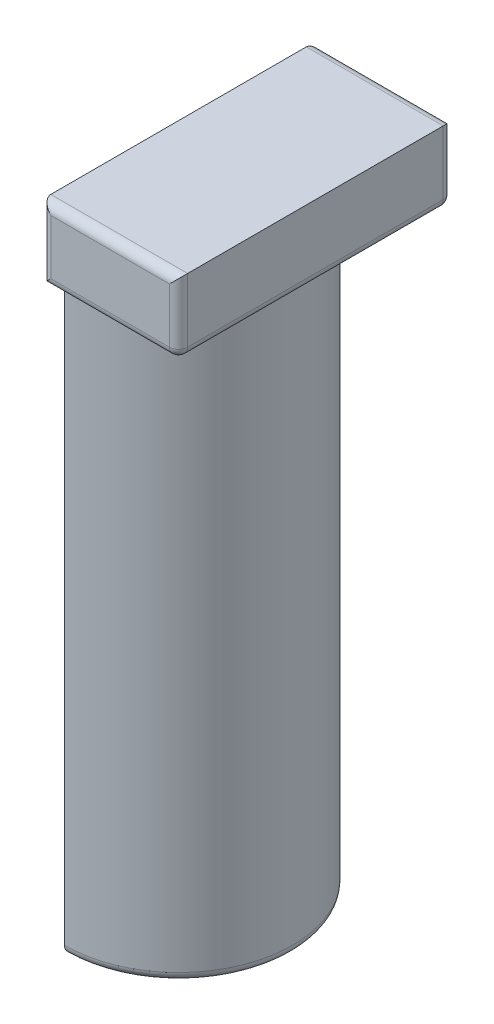
from build123d import *

# Parameters (mm, degrees)
SKETCH_1_W          = 30
SKETCH_1_H          = 30
EXTRUDE_1_DEPTH     = 8
SKETCH_2_R          = 12.5
EXTRUDE_2_DEPTH     = 65
SKETCH_3_W          = 15
SKETCH_3_H          = 30
CUT_EXTRUDE_1_DEPTH = 85.433405711
FILLET_1_R          = 1
FILLET_2_R          = 1


with BuildPart() as part:
    # 草图1 → 凸台-拉伸1 (new body)
    with BuildSketch(Plane(origin=(0, 0, 0), x_dir=(1, 0, 0), z_dir=(0, 1, 0))):
        with Locations((-15, 15)):
            Rectangle(SKETCH_1_W, SKETCH_1_H)
    extrude(amount=EXTRUDE_1_DEPTH)

    # 草图2 → 凸台-拉伸2 (add)
    with BuildSketch(Plane.XZ):
        with Locations(Location((-15, -15, 0), (0, 0, 270))):
            Circle(SKETCH_2_R)
    extrude(amount=EXTRUDE_2_DEPTH)

    # 草图3 → 切除-拉伸1 (cut, through all)
    with BuildSketch(Plane(origin=(0, 8, 0), x_dir=(1, 0, 0), z_dir=(0, 1, 0))):
        with Locations((-22.5, 15)):
            Rectangle(SKETCH_3_W, SKETCH_3_H)
    extrude(amount=-CUT_EXTRUDE_1_DEPTH, mode=Mode.SUBTRACT)

    # 圆角1
    fillet_1_edges = [part.edges().sort_by_distance(p)[0] for p in [
        (-2.5, -65, -15),
    ]]
    fillet(fillet_1_edges, radius=FILLET_1_R)

    # 圆角2
    fillet_2_edges = [part.edges().sort_by_distance(p)[0] for p in [
        (-7.5, 0, 0),
        (-7.5, 8, 0),
        (-15, 4, 0),
        (-15, 4, -30),
        (-7.5, 0, -30),
        (0, 0, -15),
        (0, 4, 0),
        (0, 4, -30),
        (-7.5, 8, -30),
    ]]
    fillet(fillet_2_edges, radius=FILLET_2_R)


solid = part.part
